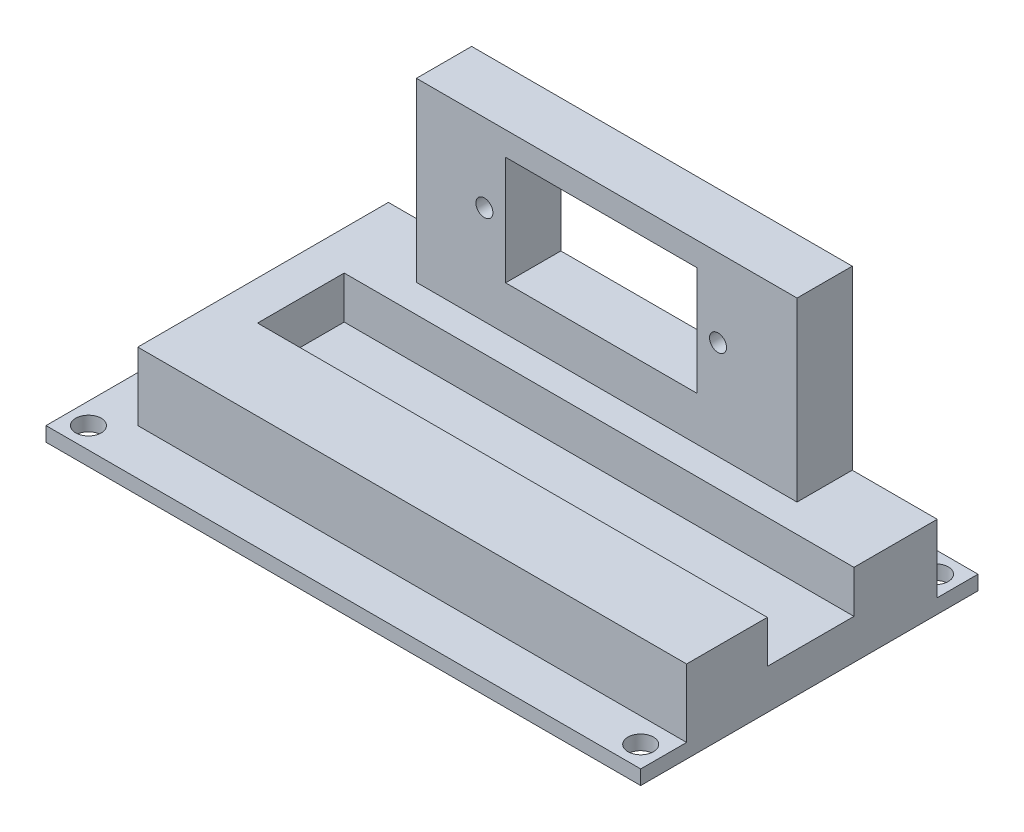
from build123d import *

# Parameters (mm, degrees)
SKETCH2_W           = 70
SKETCH2_H           = 39.7
BOSS_EXTRUDE1_DEPTH = 1.7
BOSS_EXTRUDE2_DEPTH = 8
SKETCH6_W           = 60
SKETCH6_H           = 10.2
BOSS_EXTRUDE3_DEPTH = 3
SKETCH7_W           = 44.8
SKETCH7_H           = 6.5
BOSS_EXTRUDE4_DEPTH = 20.8
CUT_EXTRUDE1_REACH  = 60.08
SKETCH8_W           = 22.5
SKETCH8_H           = 12.8
CUT_EXTRUDE2_REACH  = 60.08
SKETCH9_R           = 1
CUT_EXTRUDE3_REACH  = 52.49
SKETCH10_R          = 1.5
SKETCH13_W          = 60
SKETCH13_H          = 5.5
CUT_EXTRUDE4_DEPTH  = 4.5
SKETCH14_W          = 60
SKETCH14_H          = 5.5
CUT_EXTRUDE5_DEPTH  = 4.5


with BuildPart() as part:
    # Sketch2 → Boss-Extrude1 (new body)
    with BuildSketch(Plane(origin=(0, 0, 0), x_dir=(1, 0, 0), z_dir=(0, 1, 0))):
        Rectangle(SKETCH2_W, SKETCH2_H)
    extrude(amount=BOSS_EXTRUDE1_DEPTH)

    # Sketch3 → Boss-Extrude2 (add)
    with BuildSketch(Plane(origin=(0, 1.7, 0), x_dir=(1, 0, 0), z_dir=(0, 1, 0))):
        Polygon((35, 15.05), (-29.6, 15.05), (-29.6, -14.45), (35, -14.45), (35, -4.95), (-25, -4.95), (-25, 5.25), (35, 5.25), align=None)
    extrude(amount=BOSS_EXTRUDE2_DEPTH)

    # Sketch6 → Boss-Extrude3 (add)
    with BuildSketch(Plane(origin=(0, 1.7, 0), x_dir=(1, 0, 0), z_dir=(0, 1, 0))):
        with Locations((5, 0.15)):
            Rectangle(SKETCH6_W, SKETCH6_H)
    extrude(amount=BOSS_EXTRUDE3_DEPTH)

    # Sketch7 → Boss-Extrude4 (add)
    with BuildSketch(Plane(origin=(0, 9.7, 0), x_dir=(1, 0, 0), z_dir=(0, 1, 0))):
        with Locations((2.6, 11.8)):
            Rectangle(SKETCH7_W, SKETCH7_H)
    extrude(amount=BOSS_EXTRUDE4_DEPTH)

    # Sketch8 → Cut-Extrude1 (cut, up to next)
    with BuildSketch(Plane(origin=(0, 0, -15.05), x_dir=(-1, 0, 0), z_dir=(0, 0, -1)), mode=Mode.PRIVATE) as cut_extrude1_sk1:
        with Locations((-1.95, 21.3)):
            Rectangle(SKETCH8_W, SKETCH8_H)
    cut_extrude1_tool1 = extrude(cut_extrude1_sk1.sketch, amount=-CUT_EXTRUDE1_REACH, mode=Mode.PRIVATE) & part.part
    add(cut_extrude1_tool1.solids().sort_by_distance((1.95, 21.3, -15.05))[0], mode=Mode.SUBTRACT)

    # Sketch9 → Cut-Extrude2 (cut, up to next)
    with BuildSketch(Plane(origin=(0, 0, -15.05), x_dir=(-1, 0, 0), z_dir=(0, 0, -1)), mode=Mode.PRIVATE) as cut_extrude2_sk1:
        with Locations((-15.7, 21.3)):
            Circle(SKETCH9_R)
    cut_extrude2_tool1 = extrude(cut_extrude2_sk1.sketch, amount=-CUT_EXTRUDE2_REACH, mode=Mode.PRIVATE) & part.part
    # Sketch9 → Cut-Extrude2 (cut, up to next)
    with BuildSketch(Plane(origin=(0, 0, -15.05), x_dir=(-1, 0, 0), z_dir=(0, 0, -1)), mode=Mode.PRIVATE) as cut_extrude2_sk2:
        with Locations((11.8, 21.3)):
            Circle(SKETCH9_R)
    cut_extrude2_tool2 = extrude(cut_extrude2_sk2.sketch, amount=-CUT_EXTRUDE2_REACH, mode=Mode.PRIVATE) & part.part
    add(cut_extrude2_tool1.solids().sort_by_distance((15.7, 21.3, -15.05))[0], mode=Mode.SUBTRACT)
    add(cut_extrude2_tool2.solids().sort_by_distance((-11.8, 21.3, -15.05))[0], mode=Mode.SUBTRACT)

    # Sketch10 → Cut-Extrude3 (cut, up to next)
    with BuildSketch(Plane.XZ, mode=Mode.PRIVATE) as cut_extrude3_sk1:
        with Locations(Location((-32.5, 17.35, 0), (0, 0, 270))):
            Circle(SKETCH10_R)
    cut_extrude3_tool1 = extrude(cut_extrude3_sk1.sketch, amount=-CUT_EXTRUDE3_REACH, mode=Mode.PRIVATE) & part.part
    # Sketch10 → Cut-Extrude3 (cut, up to next)
    with BuildSketch(Plane.XZ, mode=Mode.PRIVATE) as cut_extrude3_sk2:
        with Locations(Location((32.5, 17.35, 0), (0, 0, 270))):
            Circle(SKETCH10_R)
    cut_extrude3_tool2 = extrude(cut_extrude3_sk2.sketch, amount=-CUT_EXTRUDE3_REACH, mode=Mode.PRIVATE) & part.part
    cut_extrude3_1 = cut_extrude3_tool1.solids().sort_by_distance((-32.5, 0, 17.35))[0]
    add(cut_extrude3_1, mode=Mode.SUBTRACT)
    cut_extrude3_2 = cut_extrude3_tool2.solids().sort_by_distance((32.5, 0, 17.35))[0]
    add(cut_extrude3_2, mode=Mode.SUBTRACT)
    cut_extrude3 = cut_extrude3_1 + cut_extrude3_2  # Cut-Extrude3 as one shape, for the pattern or mirror that repeats it

    # Mirror1: Cut-Extrude3 across plane
    add(cut_extrude3.mirror(Plane.XY), mode=Mode.SUBTRACT)

    # Sketch13 → Cut-Extrude4 (cut)
    with BuildSketch(Plane.XZ):
        with Locations((2.2, -10.6)):
            Rectangle(SKETCH13_W, SKETCH13_H)
    extrude(amount=-CUT_EXTRUDE4_DEPTH, mode=Mode.SUBTRACT)

    # Sketch14 → Cut-Extrude5 (cut)
    with BuildSketch(Plane.XZ):
        with Locations((2.5, 10.1)):
            Rectangle(SKETCH14_W, SKETCH14_H)
    extrude(amount=-CUT_EXTRUDE5_DEPTH, mode=Mode.SUBTRACT)


solid = part.part
